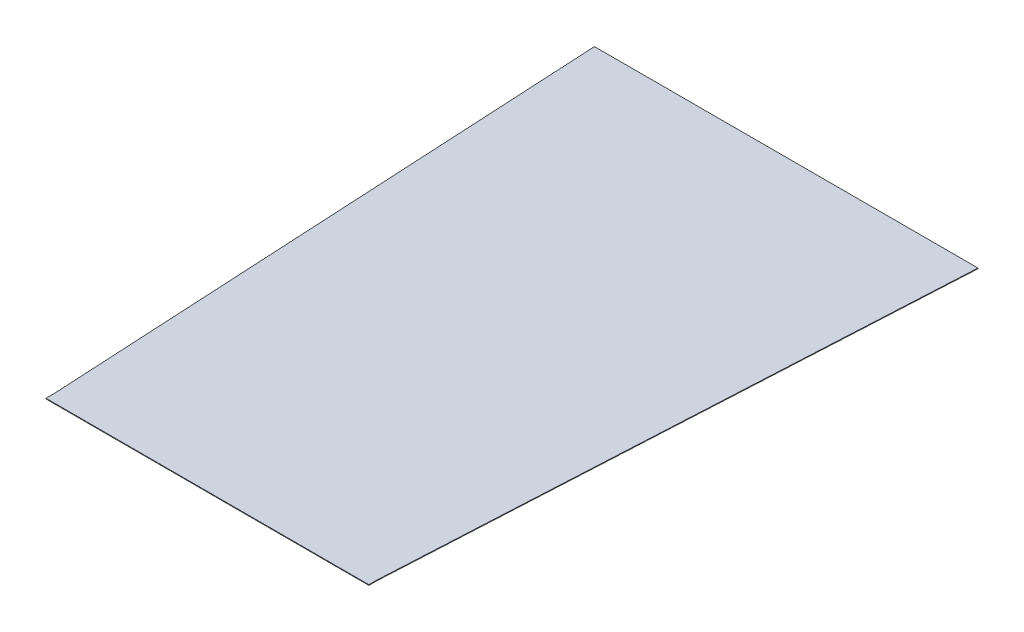
from build123d import *

# Parameters (mm, degrees)
FRONT_FLOOR_CLOSEOUT_DEPTH = 1


with BuildPart() as part:
    # Sketch1 → Front Floor Closeout (new body)
    with BuildSketch(Plane(origin=(0, 0, 0), x_dir=(1, 0, 0), z_dir=(0, 1, 0))):
        Polygon((-247.7, 0), (247.7, 0), (247.7, 12.02), (294.245, 888.034340907), (-294.245, 888.034340907), (-247.7, 12.02), align=None)
    extrude(amount=FRONT_FLOOR_CLOSEOUT_DEPTH)


solid = part.part
